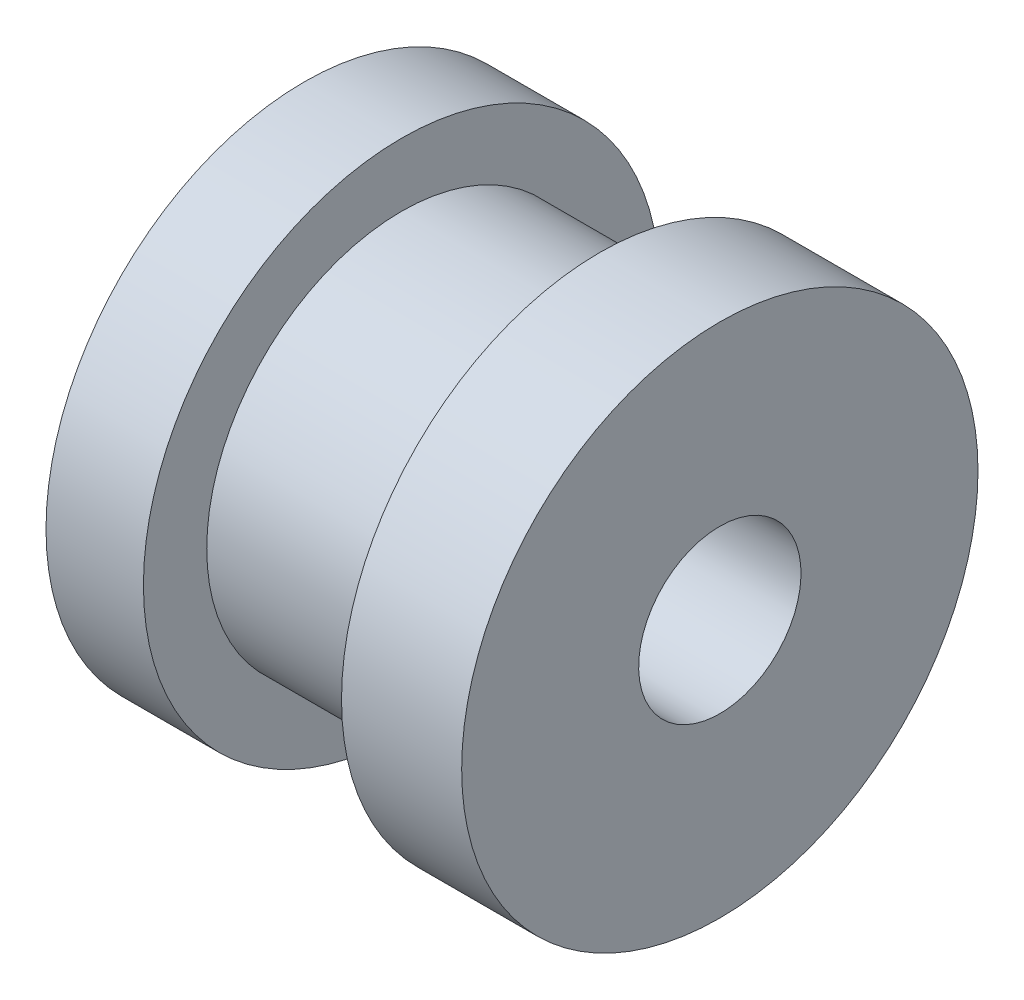
from build123d import *

# Parameters (mm, degrees)
HOLE_WIZARD_G1_81_D           = 8.8
HOLE_WIZARD_G1_81_DEPTH       = 9
HOLE_WIZARD_G1_81_CSINK_D     = 11.3
HOLE_WIZARD_G1_81_CSINK_ANGLE = 90


with BuildPart() as part:
    # Эскиз2 → Повернуть1 (revolve)
    with BuildSketch(Plane.XY):
        Polygon((-12.8, 2.5), (-12.8, 7.95), (-9.8, 7.95), (-9.8, 6), (-3.7, 6), (-3.7, 7.95), (0, 7.95), (0, 2.5), align=None)
    revolve(axis=Axis((0, 0, 0), (-1, 0, 0)))

    # Отверстие обработанное метчиком G1/81
    with Locations(Plane(origin=(-12.8, 0, 0), x_dir=(0, -1, 0), z_dir=(-1, 0, 0))):
        with Locations((0, 0)):
            CounterSinkHole(HOLE_WIZARD_G1_81_D / 2, HOLE_WIZARD_G1_81_CSINK_D / 2, depth=HOLE_WIZARD_G1_81_DEPTH, counter_sink_angle=HOLE_WIZARD_G1_81_CSINK_ANGLE)


solid = part.part
